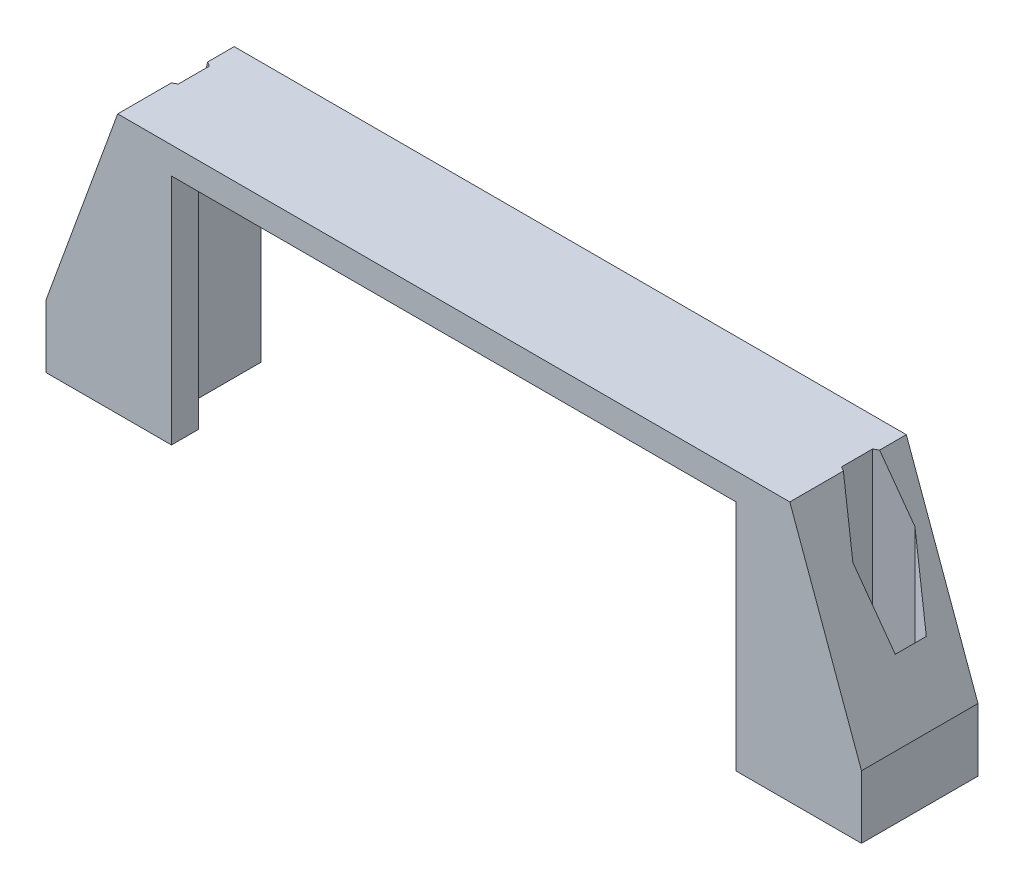
from build123d import *

# Parameters (mm, degrees)
BOSS_EXTRUDE1_DEPTH = 10
CUT_EXTRUDE1_DEPTH  = 40
SKETCH2_3_R         = 1.85
CUT_EXTRUDE2_DEPTH  = 40
BOSS_EXTRUDE2_DEPTH = 3


with BuildPart() as part:
    # Sketch1 → Boss-Extrude1 (new body)
    with BuildSketch(Plane.XY):
        Polygon((0, 26), (34.5, 26), (34.5, 0), (45.5, 0), (45.5, 7.020180644), (37.5, 29), (0, 29), align=None)
    extrude(amount=BOSS_EXTRUDE1_DEPTH)

    # Sketch2 → Cut-Extrude1 (cut)
    with BuildSketch(Plane(origin=(0, 7.020180644, 0), x_dir=(1, 0, 0), z_dir=(0, 1, 0))):
        Polygon((37, -6.732050808), (40, -8.464101615), (43, -6.732050808), (43, -3.267949192), (40, -1.535898385), (37, -3.267949192), align=None)
    extrude(amount=CUT_EXTRUDE1_DEPTH, mode=Mode.SUBTRACT)

    # Sketch2<3> → Cut-Extrude2 (cut)
    with BuildSketch(Plane(origin=(0, 7.020180644, 0), x_dir=(1, 0, 0), z_dir=(0, 1, 0))):
        with Locations((40, -5)):
            Circle(SKETCH2_3_R)
    extrude(amount=-CUT_EXTRUDE2_DEPTH, mode=Mode.SUBTRACT)

    # Mirror1: part across plane


with BuildPart() as part_1:
    add(part.part)
    add(part.part.mirror(Plane(origin=(0, 29, 10), x_dir=(0, 0, 1), z_dir=(1, 0, 0))))

    # Sketch3 → Boss-Extrude2 (add)
    with BuildSketch(Plane.XY.offset(10)):
        Polygon((31.5, 0), (45.5, 0), (45.5, 7.020180644), (37.5, 29), (-37.5, 29), (-45.5, 7.020180644), (-45.5, 0), (-31.5, 0), (-31.5, 26), (31.5, 26), align=None)
    extrude(amount=BOSS_EXTRUDE2_DEPTH)


solid = part_1.part
